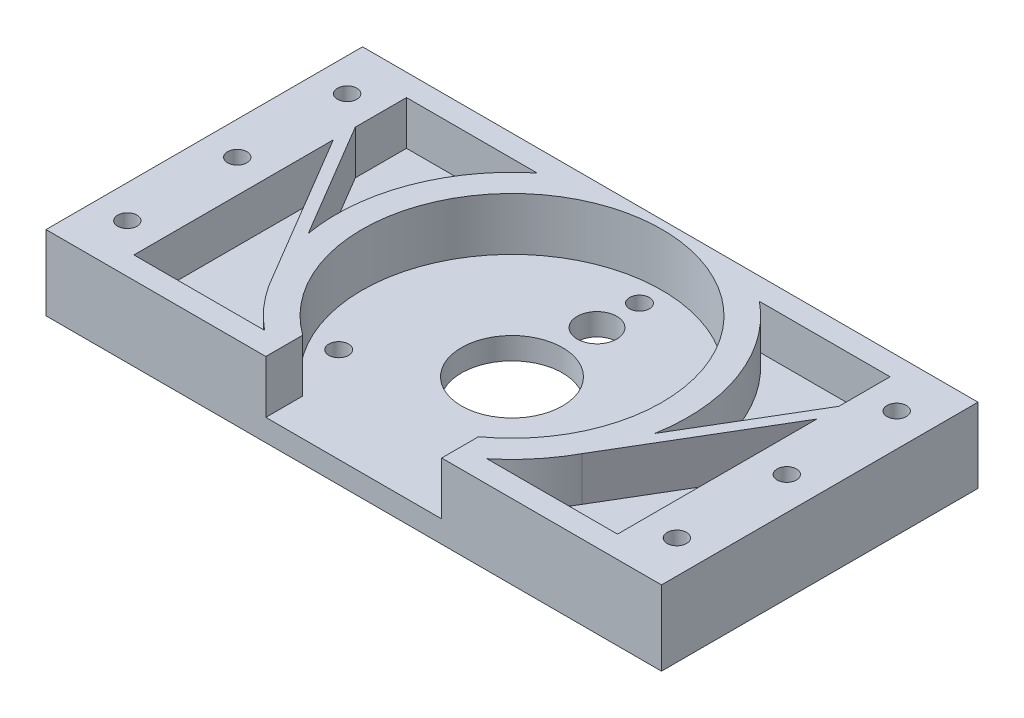
from build123d import *

# Parameters (mm, degrees)
SKETCH1_W           = 140
SKETCH1_H           = 72
BOSS_EXTRUDE1_DEPTH = 17
SKETCH2_R           = 34.1
CUT_EXTRUDE1_DEPTH  = 12
SKETCH3_W           = 40
SKETCH3_H           = 24
CUT_EXTRUDE2_DEPTH  = 10
SKETCH4_R           = 2.2
CUT_EXTRUDE3_DEPTH  = 81.529497701
SKETCH5_R           = 2.25
SKETCH5_R_2         = 4.5
CUT_EXTRUDE4_DEPTH  = 80.62411695
CUT_EXTRUDE5_DEPTH  = 10
SKETCH7_R           = 11.5
CUT_EXTRUDE6_DEPTH  = 10


with BuildPart() as part:
    # Sketch1 → Boss-Extrude1 (new body)
    with BuildSketch(Plane(origin=(0, 0, 0), x_dir=(1, 0, 0), z_dir=(0, 1, 0))):
        Rectangle(SKETCH1_W, SKETCH1_H)
    extrude(amount=BOSS_EXTRUDE1_DEPTH)

    # Sketch2 → Cut-Extrude1 (cut)
    with BuildSketch(Plane(origin=(0, 17, 0), x_dir=(1, 0, 0), z_dir=(0, 1, 0))):
        with Locations(Location((0, 0, 0), (0, 0, 270))):
            Circle(SKETCH2_R)
    extrude(amount=-CUT_EXTRUDE1_DEPTH, mode=Mode.SUBTRACT)

    # Sketch3 → Cut-Extrude2 (cut)
    with BuildSketch(Plane.XY.offset(36)):
        with Locations((0, 17)):
            Rectangle(SKETCH3_W, SKETCH3_H)
    extrude(amount=-CUT_EXTRUDE2_DEPTH, mode=Mode.SUBTRACT)

    # Sketch4 → Cut-Extrude3 (cut, through all)
    with BuildSketch(Plane(origin=(0, 17, 0), x_dir=(1, 0, 0), z_dir=(0, 1, 0))):
        with Locations(Location((-62.5, 25, 0), (0, 0, 270))):
            Circle(SKETCH4_R)
        with Locations(Location((-62.5, 0, 0), (0, 0, 270))):
            Circle(SKETCH4_R)
        with Locations(Location((-62.5, -25, 0), (0, 0, 270))):
            Circle(SKETCH4_R)
        with Locations(Location((62.5, -25, 0), (0, 0, 90))):
            Circle(SKETCH4_R)
        with Locations(Location((62.5, 0, 0), (0, 0, 90))):
            Circle(SKETCH4_R)
        with Locations(Location((62.5, 25, 0), (0, 0, 90))):
            Circle(SKETCH4_R)
    extrude(amount=-CUT_EXTRUDE3_DEPTH, mode=Mode.SUBTRACT)

    # Sketch5 → Cut-Extrude4 (cut, through all)
    with BuildSketch(Plane(origin=(0, 5, 0), x_dir=(1, 0, 0), z_dir=(0, 1, 0))):
        with Locations(Location((0, 29, 0), (0, 0, 270))):
            Circle(SKETCH5_R)
        with Locations(Location((25.042343364, -14.374611046, 0), (0, 0, 270))):
            Circle(SKETCH5_R)
        with Locations(Location((-25.042343364, -14.374611046, 0), (0, 0, 270))):
            Circle(SKETCH5_R)
        with Locations(Location((0, 19.333592636, 0), (0, 0, 270))):
            Circle(SKETCH5_R_2)
    extrude(amount=-CUT_EXTRUDE4_DEPTH, mode=Mode.SUBTRACT)

    # Sketch6 → Cut-Extrude5 (cut)
    with BuildSketch(Plane(origin=(0, 17, 0), x_dir=(1, 0, 0), z_dir=(0, 1, 0))):
        with BuildLine():
            Line((-55, 31), (-25.27844932, 31))
            ThreePointArc((-25.27844932, 31), (-37.491645865, 13.941896942), (-39.391334679, -6.951456838))
            Line((-39.391334679, -6.951456838), (-55, 19.35498509))
            Line((-55, 19.35498509), (-55, 31))
        make_face()
        with BuildLine():
            Line((-55, -31), (-25.27844932, -31))
            ThreePointArc((-25.27844932, -31), (-30.757821307, -25.5725718), (-35.093761786, -19.194475343))
            Line((-35.093761786, -19.194475343), (-55, 14.35498509))
            Line((-55, 14.35498509), (-55, -31))
        make_face()
        with BuildLine():
            Line((55, -31), (25.27844932, -31))
            ThreePointArc((25.27844932, -31), (30.757821307, -25.5725718), (35.093761786, -19.194475343))
            Line((35.093761786, -19.194475343), (55, 14.35498509))
            Line((55, 14.35498509), (55, -31))
        make_face()
        with BuildLine():
            Line((55, 31), (55, 19.35498509))
            Line((55, 19.35498509), (39.391334679, -6.951456838))
            ThreePointArc((39.391334679, -6.951456838), (37.491645865, 13.941896942), (25.27844932, 31))
            Line((25.27844932, 31), (55, 31))
        make_face()
    extrude(amount=-CUT_EXTRUDE5_DEPTH, mode=Mode.SUBTRACT)

    # Sketch7 → Cut-Extrude6 (cut)
    with BuildSketch(Plane(origin=(0, 5, 0), x_dir=(1, 0, 0), z_dir=(0, 1, 0))):
        with Locations(Location((0, 0, 0), (0, 0, 270))):
            Circle(SKETCH7_R)
    extrude(amount=-CUT_EXTRUDE6_DEPTH, mode=Mode.SUBTRACT)


solid = part.part
